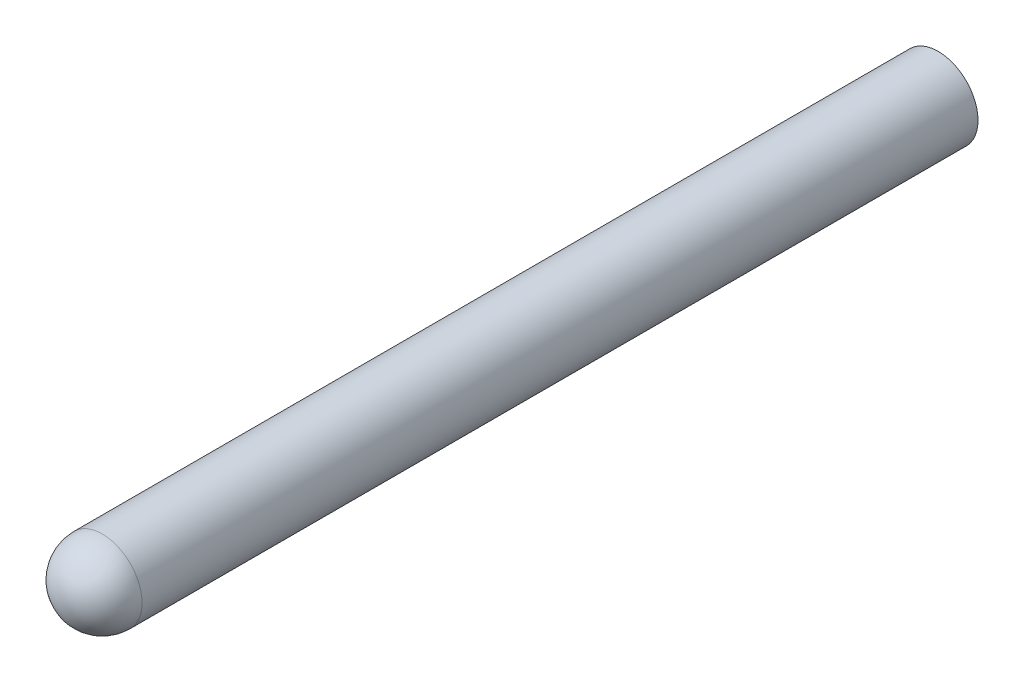
from build123d import *

# Parameters (mm, degrees)
SKETCH1_R           = 12.7
SKETCH1_R_2         = 8.89
BOSS_EXTRUDE1_DEPTH = 266.7
SKETCH3_R           = 10.16
CUT_EXTRUDE1_DEPTH  = 12.7
CHAMFER1_SIZE       = 1.27
FILLET1_R           = 0.635


with BuildPart() as part:
    # Sketch1 → Boss-Extrude1 (new body)
    with BuildSketch(Plane.XY):
        Circle(SKETCH1_R)
        Circle(SKETCH1_R_2, mode=Mode.SUBTRACT)
    extrude(amount=BOSS_EXTRUDE1_DEPTH)

    # Sketch2 → Revolve1 (revolve)
    with BuildSketch(Plane(origin=(0, 0, 0), x_dir=(1, 0, 0), z_dir=(0, 1, 0))):
        with BuildLine():
            Line((-12.7, -266.7), (0, -266.7))
            Line((0, -266.7), (0, -279.4))
            ThreePointArc((0, -279.4), (-8.980256121, -275.680256121), (-12.7, -266.7))
        make_face()
    revolve(axis=Axis((0, 0, 279.4), (0, 0, -1)))

    # Sketch3 → Cut-Extrude1 (cut)
    with BuildSketch(Plane(origin=(0, 0, 0), x_dir=(-1, 0, 0), z_dir=(0, 0, -1))):
        Circle(SKETCH3_R)
    extrude(amount=-CUT_EXTRUDE1_DEPTH, mode=Mode.SUBTRACT)

    # Chamfer1
    chamfer1_edges = [part.edges().sort_by_distance(p)[0] for p in [
        (10.16, 0, 0),
    ]]
    chamfer(chamfer1_edges, length=CHAMFER1_SIZE)

    # Fillet1
    fillet1_edges = [part.edges().sort_by_distance(p)[0] for p in [
        (10.16, 0, 12.7),
    ]]
    fillet(fillet1_edges, radius=FILLET1_R)


solid = part.part
